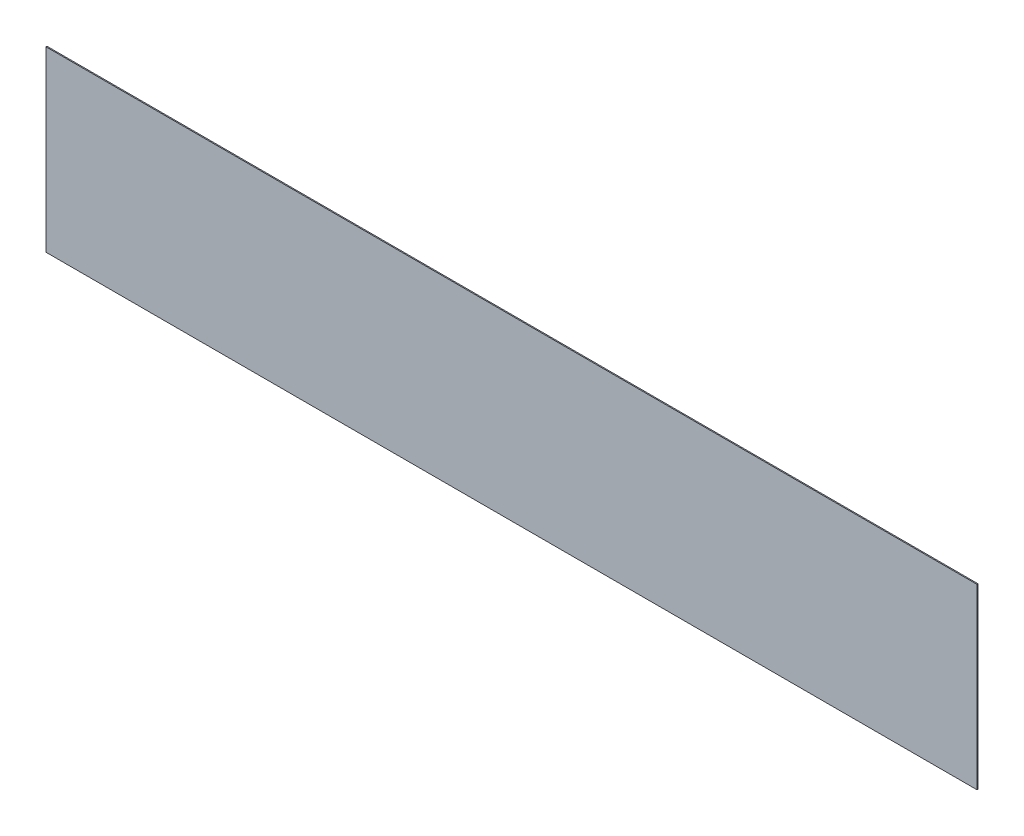
from build123d import *

# Parameters (mm, degrees)
SKETCH1_W           = 450
SKETCH1_H           = 86
BOSS_EXTRUDE1_DEPTH = 0.5


with BuildPart() as part:
    # Sketch1 → Boss-Extrude1 (new body)
    with BuildSketch(Plane.XY):
        with Locations((-12, -487.239987925)):
            Rectangle(SKETCH1_W, SKETCH1_H)
    extrude(amount=BOSS_EXTRUDE1_DEPTH)


solid = part.part
